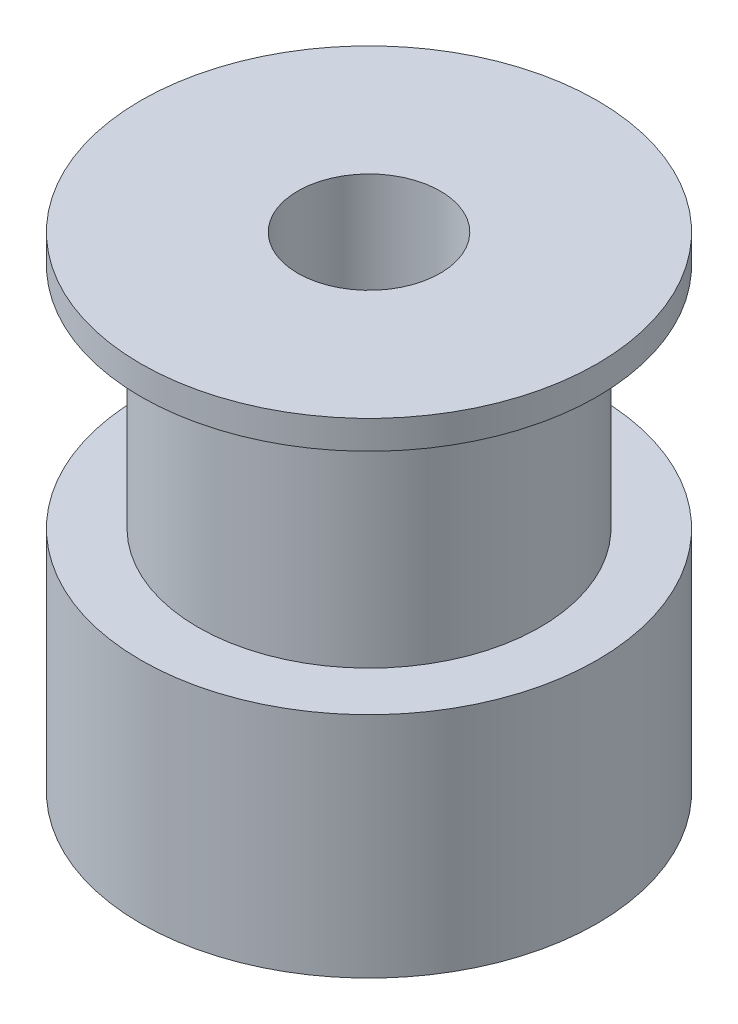
from build123d import *

# Parameters (mm, degrees)
SKETCH1_R           = 8
BOSS_EXTRUDE1_DEPTH = 8
SKETCH2_R           = 6
BOSS_EXTRUDE2_DEPTH = 8
SKETCH3_R           = 8
BOSS_EXTRUDE3_DEPTH = 1
SKETCH4_R           = 2.5
CUT_EXTRUDE1_DEPTH  = 21.420577857


with BuildPart() as part:
    # Sketch1 → Boss-Extrude1 (new body)
    with BuildSketch(Plane(origin=(0, 0, 0), x_dir=(1, 0, 0), z_dir=(0, 1, 0))):
        with Locations(Location((0, 0, 0), (0, 0, 270))):
            Circle(SKETCH1_R)
    extrude(amount=BOSS_EXTRUDE1_DEPTH)

    # Sketch2 → Boss-Extrude2 (add)
    with BuildSketch(Plane(origin=(0, 8, 0), x_dir=(1, 0, 0), z_dir=(0, 1, 0))):
        with Locations(Location((0, 0, 0), (0, 0, 270))):
            Circle(SKETCH2_R)
    extrude(amount=BOSS_EXTRUDE2_DEPTH)

    # Sketch3 → Boss-Extrude3 (add)
    with BuildSketch(Plane(origin=(0, 16, 0), x_dir=(1, 0, 0), z_dir=(0, 1, 0))):
        with Locations(Location((0, 0, 0), (0, 0, 270))):
            Circle(SKETCH3_R)
    extrude(amount=BOSS_EXTRUDE3_DEPTH)

    # Sketch4 → Cut-Extrude1 (cut, through all)
    with BuildSketch(Plane(origin=(0, 17, 0), x_dir=(1, 0, 0), z_dir=(0, 1, 0))):
        with Locations(Location((0, 0, 0), (0, 0, 270))):
            Circle(SKETCH4_R)
    extrude(amount=-CUT_EXTRUDE1_DEPTH, mode=Mode.SUBTRACT)


solid = part.part
